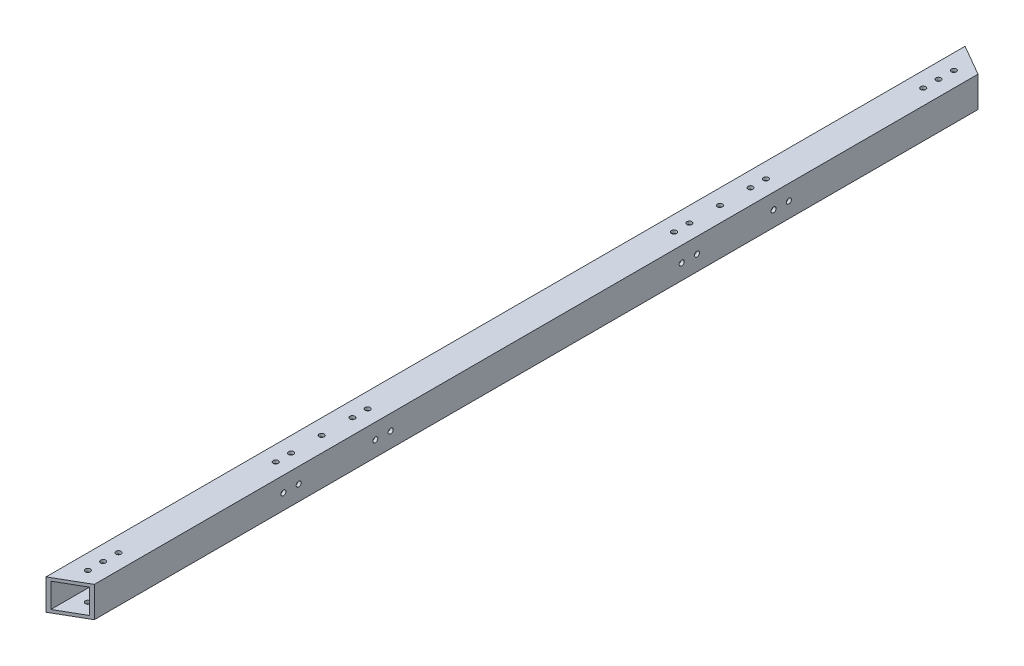
from build123d import *

# Parameters (mm, degrees)
SKETCH_1_W          = 20
SKETCH_1_H          = 20
SKETCH_1_W_2        = 16
SKETCH_1_H_2        = 16
EXTRUDE_1_DEPTH     = 600
CUT_EXTRUDE_1_DEPTH = 300
SKETCH_3_R          = 1.65
CUT_EXTRUDE_2_DEPTH = 300
SKETCH_4_R          = 1.65
CUT_EXTRUDE_3_DEPTH = 10
SKETCH_6_R          = 1.65
CUT_EXTRUDE_4_DEPTH = 601.416522091


with BuildPart() as part:
    # 草图1 → 凸台-拉伸1 (new body)
    with BuildSketch(Plane.XY):
        Rectangle(SKETCH_1_W, SKETCH_1_H)
        Rectangle(SKETCH_1_W_2, SKETCH_1_H_2, mode=Mode.SUBTRACT)
    extrude(amount=EXTRUDE_1_DEPTH)

    # 草图2 → 切除-拉伸1 (cut, symmetric)
    with BuildSketch(Plane(origin=(0, 10, 0), x_dir=(1, 0, 0), z_dir=(0, 1, 0))):
        Polygon((-10, 0), (10, -11.547005384), (10, 0), align=None)
        Polygon((10, -600), (-10, -600), (10, -588.452994616), align=None)
    extrude(amount=CUT_EXTRUDE_1_DEPTH, both=True, mode=Mode.SUBTRACT)

    # 草图3 → 切除-拉伸2 (cut, symmetric)
    with BuildSketch(Plane(origin=(0, 10, 0), x_dir=(1, 0, 0), z_dir=(0, 1, 0))):
        with Locations(Location((0, -17.318286674, 0), (0, 0, 270))):
            Circle(SKETCH_3_R)
        with Locations(Location((0, -582.681713326, 0), (0, 0, 270))):
            Circle(SKETCH_3_R)
        with Locations(Location((0, -27.318286674, 0), (0, 0, 270))):
            Circle(SKETCH_3_R)
        with Locations(Location((0, -37.318286674, 0), (0, 0, 270))):
            Circle(SKETCH_3_R)
        with Locations(Location((0, -562.681713326, 0), (0, 0, 270))):
            Circle(SKETCH_3_R)
        with Locations(Location((0, -572.681713326, 0), (0, 0, 270))):
            Circle(SKETCH_3_R)
    extrude(amount=CUT_EXTRUDE_2_DEPTH, both=True, mode=Mode.SUBTRACT)

    # 草图4 → 切除-拉伸3 (cut, symmetric)
    with BuildSketch(Plane(origin=(0, 0, 0), x_dir=(1, 0, 0), z_dir=(0, 1, 0))):
        with Locations(Location((0, -169.998286674, 0), (0, 0, 270))):
            Circle(SKETCH_4_R)
        with Locations(Location((0, -429.998286674, 0), (0, 0, 270))):
            Circle(SKETCH_4_R)
        with Locations(Location((0, -149.998286674, 0), (0, 0, 270))):
            Circle(SKETCH_4_R)
        with Locations(Location((0, -189.998286674, 0), (0, 0, 270))):
            Circle(SKETCH_4_R)
        with Locations(Location((0, -409.998286674, 0), (0, 0, 270))):
            Circle(SKETCH_4_R)
        with Locations(Location((0, -449.998286674, 0), (0, 0, 270))):
            Circle(SKETCH_4_R)
        with Locations(Location((0, -199.998286674, 0), (0, 0, 270))):
            Circle(SKETCH_4_R)
        with Locations(Location((0, -139.998286674, 0), (0, 0, 270))):
            Circle(SKETCH_4_R)
        with Locations(Location((0, -459.998286674, 0), (0, 0, 270))):
            Circle(SKETCH_4_R)
        with Locations(Location((0, -399.998286674, 0), (0, 0, 270))):
            Circle(SKETCH_4_R)
    extrude(amount=CUT_EXTRUDE_3_DEPTH, both=True, mode=Mode.SUBTRACT)

    # 草图6 → 切除-拉伸4 (cut, through all)
    with BuildSketch(Plane.ZY.offset(10)):
        with Locations((195, 0)):
            Circle(SKETCH_6_R)
        with Locations((145, 0)):
            Circle(SKETCH_6_R)
        with Locations((205, 0)):
            Circle(SKETCH_6_R)
        with Locations((135, 0)):
            Circle(SKETCH_6_R)
        with Locations((465, 0)):
            Circle(SKETCH_6_R)
        with Locations((395, 0)):
            Circle(SKETCH_6_R)
        with Locations((455, 0)):
            Circle(SKETCH_6_R)
        with Locations((405, 0)):
            Circle(SKETCH_6_R)
    extrude(amount=-CUT_EXTRUDE_4_DEPTH, mode=Mode.SUBTRACT)


solid = part.part
